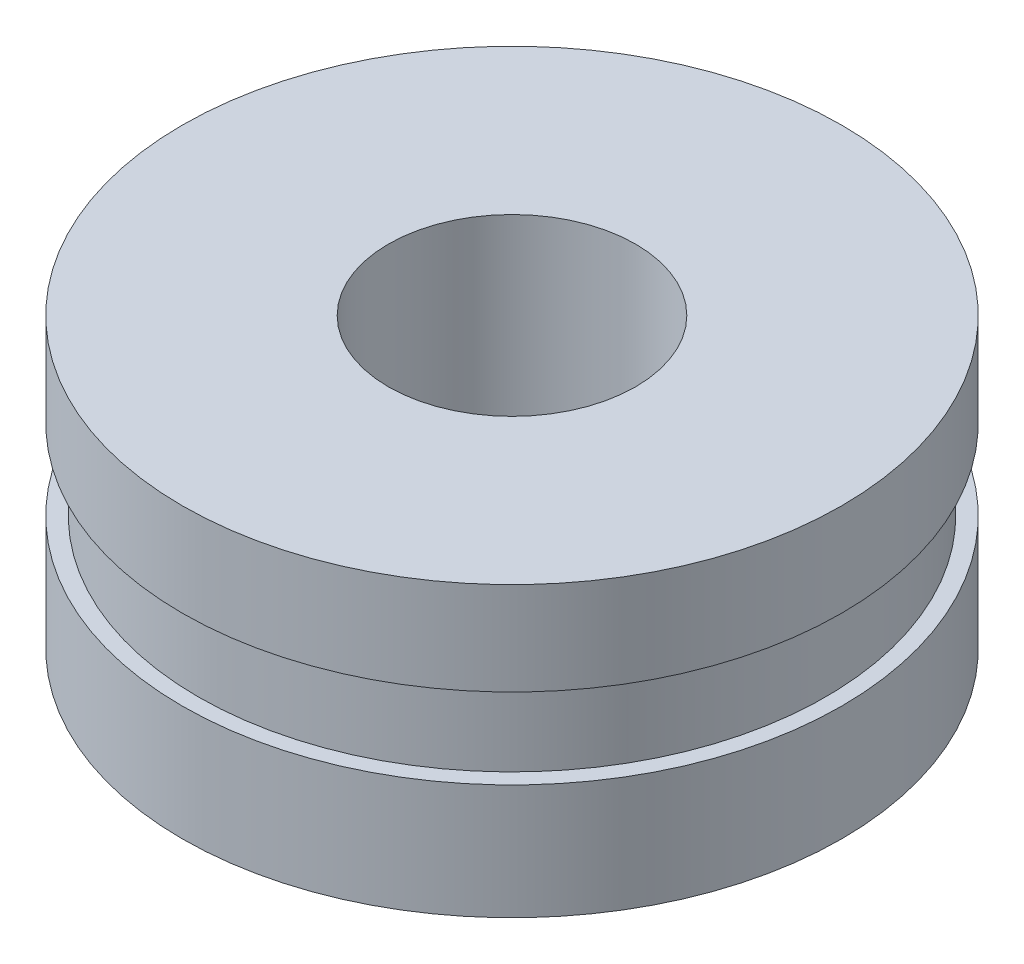
from build123d import *

# Parameters (mm, degrees)
SKETCH_1_R      = 4
SKETCH_1_R_2    = 1.5
EXTRUDE_1_DEPTH = 3.5
SKETCH_2_W      = 0.193229727
SKETCH_2_H      = 0.975939513


with BuildPart() as part:
    # 草图1 → 凸台-拉伸1 (new body)
    with BuildSketch(Plane(origin=(0, 0, 0), x_dir=(1, 0, 0), z_dir=(0, 1, 0))):
        with Locations(Location((0, 0, 0), (0, 0, 270))):
            Circle(SKETCH_1_R)
        with Locations(Location((0, 0, 0), (0, 0, 270))):
            Circle(SKETCH_1_R_2, mode=Mode.SUBTRACT)
    extrude(amount=EXTRUDE_1_DEPTH)

    # 草图2 → 切除-旋转1 (revolve, cut)
    with BuildSketch(Plane.XY, mode=Mode.PRIVATE) as cut_revolve_1_sk:
        with Locations((-3.903385136, 1.883358194)):
            Rectangle(SKETCH_2_W, SKETCH_2_H)
    revolve(cut_revolve_1_sk.sketch.rotate(Axis((0, 3.5, 0), (0, -1, 0)), 270), axis=Axis((0, 3.5, 0), (0, -1, 0)), mode=Mode.SUBTRACT)


solid = part.part
